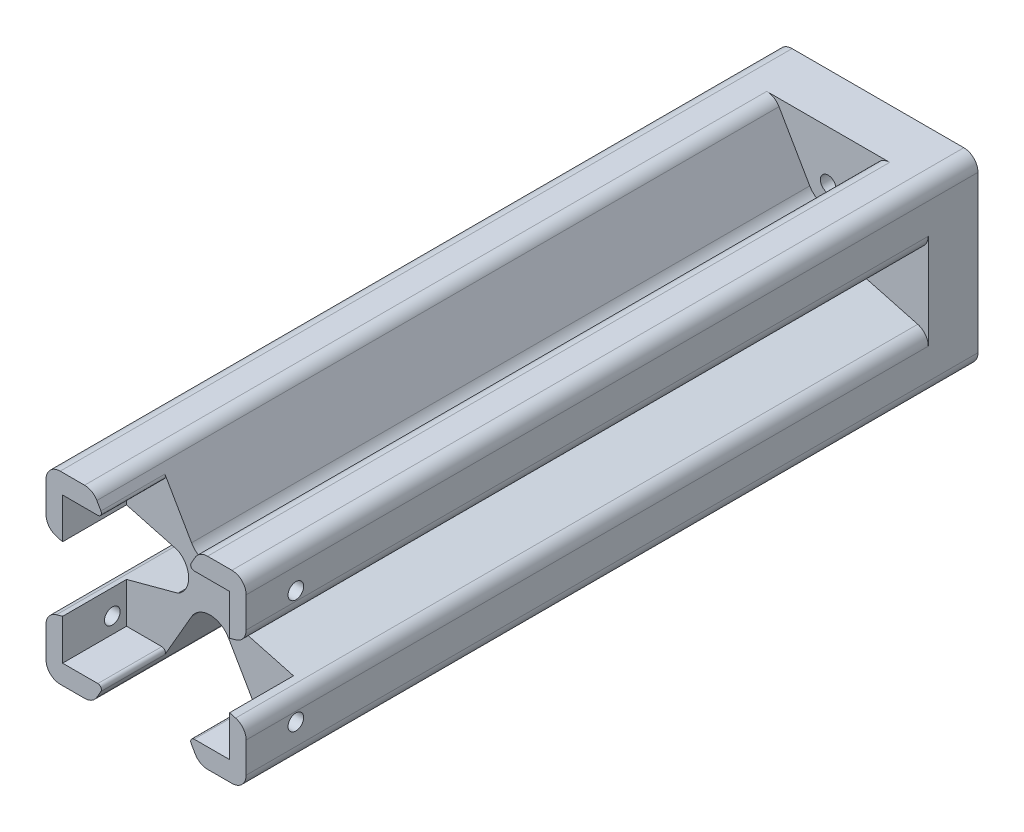
from build123d import *
from build123d.topology import SkipClean

# Parameters (mm, degrees)
SKETCH_1_R               = 15
EXTRUDE_1_DEPTH          = 91
SKETCH_2_R               = 1.1
CUT_EXTRUDE_1_DEPTH      = 10
SKETCH_3_W               = 28.98
SKETCH_3_H               = 25.98
SKETCH_3_W_2             = 23.5
SKETCH_3_H_2             = 20.5
EXTRUDE_2_DEPTH          = 9
CUT_EXTRUDE_2_DEPTH      = 87
SKETCH_6_W               = 28.98
SKETCH_6_H               = 25.98
EXTRUDE_6_DEPTH          = 5
SKETCH_7_R               = 1.1
CUT_EXTRUDE_3_DEPTH      = 106.331192436
SKETCH_10_R              = 0.8
CUT_EXTRUDE_4_DEPTH      = 99.315817649
CUT_EXTRUDE_5_DEPTH      = 89.577649551
FILLET_1_R               = 0.5
EXTRUDE_7_DEPTH          = 82
SKETCH_17_W              = 0.407540604
SKETCH_17_H              = 25.98
CUT_EXTRUDE_7_DEPTH      = 89.577649551
FILLET_3_R               = 2
CUT_EXTRUDE_6_DEPTH      = 89.577649551
PATTERN_CIRCULAR_4_COUNT = 4
BOSS_EXTRUDE1_START      = 86
BOSS_EXTRUDE1_DEPTH      = 86
SKETCH3_OUTSIDE_W        = 53.726
SKETCH3_OUTSIDE_H        = 53.726
CUT_EXTRUDE1_DEPTH       = 103.225241501
SKETCH4_R                = 10
SKETCH4_R_2              = 0.8
BOSS_EXTRUDE2_DEPTH      = 3
FILLET1_R                = 2
SKETCH5_R                = 0.8
BOSS_EXTRUDE3_DEPTH      = 7


with BuildPart() as part:
    # 草图1 → 凸台-拉伸1 (new body)
    with BuildSketch(Plane.XY):
        Circle(SKETCH_1_R)
    extrude(amount=EXTRUDE_1_DEPTH)

    # 草图2 → 切除-拉伸1 (cut)
    with BuildSketch(Plane(origin=(0, 0, 0), x_dir=(-1, 0, 0), z_dir=(0, 0, -1))):
        with Locations((0, 6)):
            Circle(SKETCH_2_R)
        with Locations(Location((0, -6, 0), (0, 0, 180))):
            Circle(SKETCH_2_R)
        with Locations((6, 0)):
            Circle(SKETCH_2_R)
        with Locations(Location((-6, 0, 0), (0, 0, 180))):
            Circle(SKETCH_2_R)
    extrude(amount=-CUT_EXTRUDE_1_DEPTH, mode=Mode.SUBTRACT)

    # 草图3 → 凸台-拉伸2 (add)
    with BuildSketch(Plane.XY.offset(91)):
        Rectangle(SKETCH_3_W, SKETCH_3_H)
        Rectangle(SKETCH_3_W_2, SKETCH_3_H_2, mode=Mode.SUBTRACT)
    extrude(amount=EXTRUDE_2_DEPTH)

    # 草图4 → 切除-拉伸2 (cut)
    with BuildSketch(Plane(origin=(0, 0, 4), x_dir=(-1, 0, 0), z_dir=(0, 0, -1))):
        with BuildLine():
            Line((-2.598076211, 4.5), (-7.5, 12.990381057))
            ThreePointArc((-7.5, 12.990381057), (0, 15), (7.5, 12.990381057))
            Line((7.5, 12.990381057), (2.598076211, 4.5))
            ThreePointArc((2.598076211, 4.5), (0, 3), (-2.598076211, 4.5))
        make_face()
        with BuildLine():
            Line((4.5, -2.598076211), (12.990381057, -7.5))
            ThreePointArc((12.990381057, -7.5), (15, 0), (12.990381057, 7.5))
            Line((12.990381057, 7.5), (4.5, 2.598076211))
            ThreePointArc((4.5, 2.598076211), (3, 0), (4.5, -2.598076211))
        make_face()
        with BuildLine():
            Line((-2.598076211, -4.5), (-7.5, -12.990381057))
            ThreePointArc((-7.5, -12.990381057), (0, -15), (7.5, -12.990381057))
            Line((7.5, -12.990381057), (2.598076211, -4.5))
            ThreePointArc((2.598076211, -4.5), (0, -3), (-2.598076211, -4.5))
        make_face()
        with BuildLine():
            Line((-4.5, 2.598076211), (-12.990381057, 7.5))
            ThreePointArc((-12.990381057, 7.5), (-15, 0), (-12.990381057, -7.5))
            Line((-12.990381057, -7.5), (-4.5, -2.598076211))
            ThreePointArc((-4.5, -2.598076211), (-3, 0), (-4.5, 2.598076211))
        make_face()
    extrude(amount=-CUT_EXTRUDE_2_DEPTH, mode=Mode.SUBTRACT)

    # 草图6 → 凸台-拉伸6 (add)
    with BuildSketch(Plane(origin=(0, 0, 91), x_dir=(-1, 0, 0), z_dir=(0, 0, -1))):
        Rectangle(SKETCH_6_W, SKETCH_6_H)
    extrude(amount=EXTRUDE_6_DEPTH)

    # 草图7 → 切除-拉伸3 (cut, through all)
    with BuildSketch(Plane(origin=(14.49, 0, 0), x_dir=(0, 0, -1), z_dir=(1, 0, 0))):
        with Locations(Location((-93, -8, 0), (0, 0, 90))):
            Circle(SKETCH_7_R)
        with Locations(Location((-93, 8, 0), (0, 0, 90))):
            Circle(SKETCH_7_R)
    extrude(amount=-CUT_EXTRUDE_3_DEPTH, mode=Mode.SUBTRACT)

    # 草图10 → 切除-拉伸4 (cut, through all)
    with BuildSketch(Plane.XY.offset(4)):
        with Locations((0, -12)):
            Circle(SKETCH_10_R)
    cut_extrude_4 = extrude(amount=-CUT_EXTRUDE_4_DEPTH, mode=Mode.SUBTRACT)

    # 草图11 → 切除-拉伸5 (cut, through all)
    with BuildSketch(Plane(origin=(0, 0, 86), x_dir=(-1, 0, 0), z_dir=(0, 0, -1))):
        with BuildLine():
            Line((2.598076211, 4.5), (7.499779997, 12.99))
            Line((7.499779997, 12.99), (-7.499779997, 12.99))
            Line((-7.499779997, 12.99), (-2.598076211, 4.5))
            ThreePointArc((-2.598076211, 4.5), (0, 3), (2.598076211, 4.5))
        make_face()
        with BuildLine():
            Line((-2.598076211, -4.5), (-7.499779997, -12.99))
            Line((-7.499779997, -12.99), (7.499779997, -12.99))
            Line((7.499779997, -12.99), (2.598076211, -4.5))
            ThreePointArc((2.598076211, -4.5), (0, -3), (-2.598076211, -4.5))
        make_face()
    extrude(amount=-CUT_EXTRUDE_5_DEPTH, mode=Mode.SUBTRACT)

    # 圆角1
    fillet_1_edges = [part.edges().sort_by_distance(p)[0] for p in [
        (5.917840259, 10.25, 95.5),
        (-5.917840259, 10.25, 95.5),
        (-5.917840259, -10.25, 95.5),
        (5.917840259, -10.25, 95.5),
    ]]
    fillet(fillet_1_edges, radius=FILLET_1_R)

    # 草图12 → 凸台-拉伸7 (add)
    with SkipClean():  # the faces are left unmerged after this step: merging them gives an invalid solid
        with BuildSketch(Plane.XY.offset(4)):
            with BuildLine():
                Line((-4.5, 2.598076211), (-14.082459396, 5.165688468))
                ThreePointArc((-14.082459396, 5.165688468), (-13.586645102, 6.356341311), (-12.990381057, 7.5))
                Line((-12.990381057, 7.5), (-4.5, 2.598076211))
            make_face()
            with BuildLine():
                Line((-12.990381057, -7.5), (-4.5, -2.598076211))
                Line((-4.5, -2.598076211), (-14.082459396, -5.165688468))
                ThreePointArc((-14.082459396, -5.165688468), (-13.586645102, -6.356341311), (-12.990381057, -7.5))
            make_face()
            with BuildLine():
                Line((4.5, -2.598076211), (14.082459396, -5.165688468))
                ThreePointArc((14.082459396, -5.165688468), (13.586645102, -6.356341311), (12.990381057, -7.5))
                Line((12.990381057, -7.5), (4.5, -2.598076211))
            make_face()
            with BuildLine():
                Line((4.5, 2.598076211), (12.990381057, 7.5))
                ThreePointArc((12.990381057, 7.5), (13.586645102, 6.356341311), (14.082459396, 5.165688468))
                Line((14.082459396, 5.165688468), (4.5, 2.598076211))
            make_face()
        extrude(amount=EXTRUDE_7_DEPTH)

    # 草图17 → 切除-拉伸7 (cut, through all)
    with SkipClean():  # the faces are left unmerged after this step: merging them gives an invalid solid
        with BuildSketch(Plane(origin=(0, 0, 86), x_dir=(-1, 0, 0), z_dir=(0, 0, -1))):
            with Locations((14.286229698, 0)):
                Rectangle(SKETCH_17_W, SKETCH_17_H)
            with Locations((-14.286229698, 0)):
                Rectangle(SKETCH_17_W, SKETCH_17_H)
        extrude(amount=-CUT_EXTRUDE_7_DEPTH, mode=Mode.SUBTRACT)

    # 圆角3
    fillet_3_edges = [part.edges().sort_by_distance(p)[0] for p in [
        (-14.082459396, -12.99, 93),
        (-14.082459396, 12.99, 93),
        (14.082459396, 12.99, 93),
        (14.082459396, -12.99, 93),
    ]]
    fillet(fillet_3_edges, radius=FILLET_3_R)

    # 草图13 → 切除-拉伸6 (cut, through all)
    with SkipClean():  # the faces are left unmerged after this step: merging them gives an invalid solid
        with BuildSketch(Plane(origin=(0, 0, 86), x_dir=(-1, 0, 0), z_dir=(0, 0, -1))):
            with BuildLine():
                Line((-4.5, -2.598076211), (-14.082459396, -5.165688468))
                Line((-14.082459396, -5.165688468), (-14.082459396, 5.165688468))
                Line((-14.082459396, 5.165688468), (-4.5, 2.598076211))
                ThreePointArc((-4.5, 2.598076211), (-3, 0), (-4.5, -2.598076211))
            make_face()
            with BuildLine():
                Line((14.082459396, 5.165688468), (14.082459396, -5.165688468))
                Line((14.082459396, -5.165688468), (4.5, -2.598076211))
                ThreePointArc((4.5, -2.598076211), (3, 0), (4.5, 2.598076211))
                Line((4.5, 2.598076211), (14.082459396, 5.165688468))
            make_face()
        extrude(amount=-CUT_EXTRUDE_6_DEPTH, mode=Mode.SUBTRACT)

    # 阵列(圆周)4: 切除-拉伸4 ×4 about axis
    with SkipClean():  # the faces are left unmerged after this step: merging them gives an invalid solid
        pattern_circular_4_axis = Axis((0, 0, 0), (0, 0, 1))
        for i in range(1, PATTERN_CIRCULAR_4_COUNT):
            add(cut_extrude_4.rotate(pattern_circular_4_axis, i * 360 / PATTERN_CIRCULAR_4_COUNT), mode=Mode.SUBTRACT)

    # Sketch1 → Boss-Extrude1 (add)
    with BuildSketch(Plane(origin=(0, 0, 86), x_dir=(-1, 0, 0), z_dir=(0, 0, -1)).offset(BOSS_EXTRUDE1_START)):
        with BuildLine():
            Line((7.500659971, -12.99), (12.082459396, -12.99))
            ThreePointArc((12.082459396, -12.99), (13.496672959, -12.404213562), (14.082459396, -10.99))
            Line((14.082459396, -10.99), (14.082459396, -5.165688468))
            ThreePointArc((14.082459396, -5.165688468), (11.478794499, -9.655945156), (7.500659971, -12.99))
        make_face()
        with BuildLine():
            Line((-14.082459396, -5.165688468), (-14.082459396, -10.99))
            ThreePointArc((-14.082459396, -10.99), (-13.496672959, -12.404213562), (-12.082459396, -12.99))
            Line((-12.082459396, -12.99), (-7.500659971, -12.99))
            ThreePointArc((-7.500659971, -12.99), (-11.478794499, -9.655945156), (-14.082459396, -5.165688468))
        make_face()
        with BuildLine():
            Line((-7.500659971, 12.99), (-12.082459396, 12.99))
            ThreePointArc((-12.082459396, 12.99), (-13.496672959, 12.404213562), (-14.082459396, 10.99))
            Line((-14.082459396, 10.99), (-14.082459396, 5.165688468))
            ThreePointArc((-14.082459396, 5.165688468), (-11.478794499, 9.655945156), (-7.500659971, 12.99))
        make_face()
        with BuildLine():
            Line((14.082459396, 5.165688468), (14.082459396, 10.99))
            ThreePointArc((14.082459396, 10.99), (13.496672959, 12.404213562), (12.082459396, 12.99))
            Line((12.082459396, 12.99), (7.500659971, 12.99))
            ThreePointArc((7.500659971, 12.99), (11.478794499, 9.655945156), (14.082459396, 5.165688468))
        make_face()
    extrude(amount=-BOSS_EXTRUDE1_DEPTH)

    # Sketch3 outside → Cut-Extrude1 (cut, through all)
    with BuildSketch(Plane(origin=(0, 0, 0), x_dir=(-1, 0, 0), z_dir=(0, 0, -1))):
        Rectangle(SKETCH3_OUTSIDE_W, SKETCH3_OUTSIDE_H)
        with BuildLine():
            Line((-7.500659971, 12.99), (7.500659971, 12.99))
            Line((7.500659971, 12.99), (12.082459396, 12.99))
            ThreePointArc((12.082459396, 12.99), (13.496672959, 12.404213562), (14.082459396, 10.99))
            Line((14.082459396, 10.99), (14.082459396, 5.165688468))
            Line((14.082459396, 5.165688468), (14.082459396, -5.165688468))
            Line((14.082459396, -5.165688468), (14.082459396, -10.99))
            ThreePointArc((14.082459396, -10.99), (13.496672959, -12.404213562), (12.082459396, -12.99))
            Line((12.082459396, -12.99), (7.500659971, -12.99))
            Line((7.500659971, -12.99), (-7.500659971, -12.99))
            Line((-7.500659971, -12.99), (-12.082459396, -12.99))
            ThreePointArc((-12.082459396, -12.99), (-13.496672959, -12.404213562), (-14.082459396, -10.99))
            Line((-14.082459396, -10.99), (-14.082459396, -5.165688468))
            Line((-14.082459396, -5.165688468), (-14.082459396, 5.165688468))
            Line((-14.082459396, 5.165688468), (-14.082459396, 10.99))
            ThreePointArc((-14.082459396, 10.99), (-13.496672959, 12.404213562), (-12.082459396, 12.99))
            Line((-12.082459396, 12.99), (-7.500659971, 12.99))
        make_face(mode=Mode.SUBTRACT)
    extrude(amount=-CUT_EXTRUDE1_DEPTH, mode=Mode.SUBTRACT)

    # Sketch4 → Boss-Extrude2 (add)
    with BuildSketch(Plane(origin=(0, 0, 0), x_dir=(-1, 0, 0), z_dir=(0, 0, -1))):
        with BuildLine():
            Line((-14.082459396, 10.99), (-14.082459396, -10.99))
            ThreePointArc((-14.082459396, -10.99), (-13.496672959, -12.404213562), (-12.082459396, -12.99))
            Line((-12.082459396, -12.99), (12.082459396, -12.99))
            ThreePointArc((12.082459396, -12.99), (13.496672959, -12.404213562), (14.082459396, -10.99))
            Line((14.082459396, -10.99), (14.082459396, 10.99))
            ThreePointArc((14.082459396, 10.99), (13.496672959, 12.404213562), (12.082459396, 12.99))
            Line((12.082459396, 12.99), (-12.082459396, 12.99))
            ThreePointArc((-12.082459396, 12.99), (-13.496672959, 12.404213562), (-14.082459396, 10.99))
        make_face()
        Circle(SKETCH4_R, mode=Mode.SUBTRACT)
        with Locations(Location((0, -12, 0), (0, 0, 180))):
            Circle(SKETCH4_R_2, mode=Mode.SUBTRACT)
        with Locations(Location((12, 0, 0), (0, 0, 270))):
            Circle(SKETCH4_R_2, mode=Mode.SUBTRACT)
        with Locations(Location((-12, 0, 0), (0, 0, 90))):
            Circle(SKETCH4_R_2, mode=Mode.SUBTRACT)
        with Locations((0, 12)):
            Circle(SKETCH4_R_2, mode=Mode.SUBTRACT)
    extrude(amount=BOSS_EXTRUDE2_DEPTH)

    # Fillet1
    fillet1_edges = [part.edges().sort_by_distance(p)[0] for p in [
        (7.499779997, 12.99, 52),
        (-7.499779997, 12.99, 52),
        (-7.499779997, -12.99, 52),
        (7.499779997, -12.99, 52),
        (-14.082459396, -5.165688468, 52),
        (-14.082459396, 5.165688468, 52),
        (14.082459396, 5.165688468, 52),
        (14.082459396, -5.165688468, 52),
    ]]
    fillet(fillet1_edges, radius=FILLET1_R)

    # Sketch5 → Boss-Extrude3 (add)
    with BuildSketch(Plane.XY.offset(4)):
        with Locations((0, -12)):
            Circle(SKETCH5_R)
        with Locations((12, 0)):
            Circle(SKETCH5_R)
        with Locations((0, 12)):
            Circle(SKETCH5_R)
        with Locations((-12, 0)):
            Circle(SKETCH5_R)
    extrude(amount=-BOSS_EXTRUDE3_DEPTH)


solid = part.part
